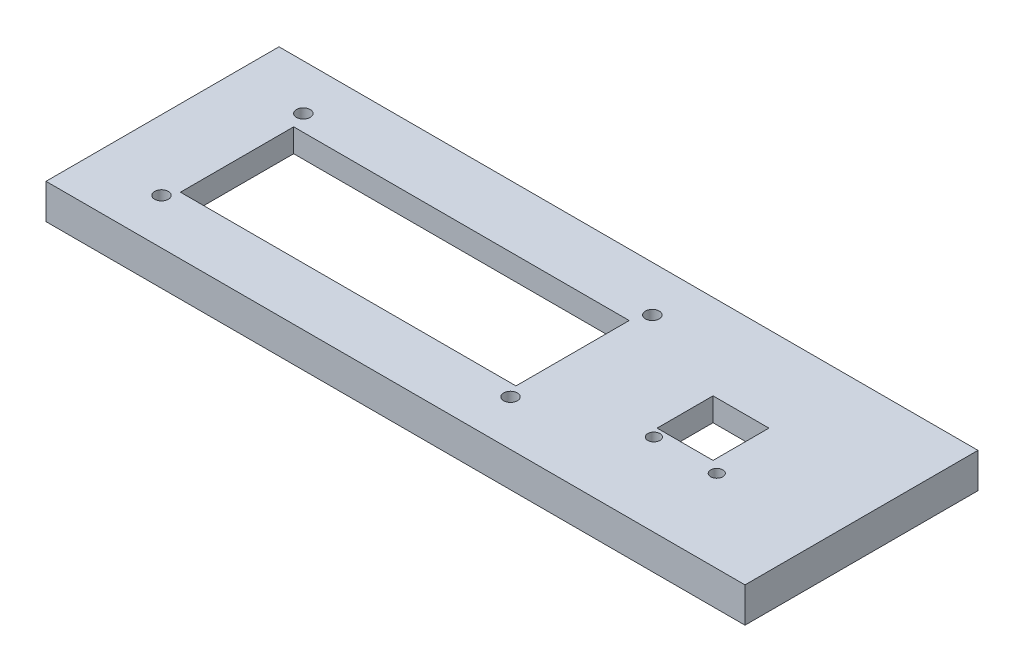
from build123d import *

# Parameters (mm, degrees)
SKETCH2_W           = 150
SKETCH2_H           = 50
BOSS_EXTRUDE1_DEPTH = 7.5
SKETCH3_R           = 1.475
CUT_EXTRUDE1_DEPTH  = 159.291661183
SKETCH4_R           = 1.3
CUT_EXTRUDE2_DEPTH  = 159.291661183
SKETCH6_W           = 140
SKETCH6_H           = 40
CUT_EXTRUDE3_DEPTH  = 2.5
SKETCH8_W           = 72
SKETCH8_H           = 24.3
CUT_EXTRUDE4_DEPTH  = 159.291661183
SKETCH9_W           = 12
SKETCH9_H           = 12
CUT_EXTRUDE5_DEPTH  = 159.291661183


with BuildPart() as part:
    # Sketch2 → Boss-Extrude1 (new body)
    with BuildSketch(Plane(origin=(0, 0, 0), x_dir=(1, 0, 0), z_dir=(0, 1, 0))):
        with Locations((75, 25)):
            Rectangle(SKETCH2_W, SKETCH2_H)
    extrude(amount=BOSS_EXTRUDE1_DEPTH)

    # Sketch3 → Cut-Extrude1 (cut, through all)
    with BuildSketch(Plane(origin=(0, 7.5, 0), x_dir=(1, 0, 0), z_dir=(0, 1, 0))):
        with Locations(Location((15, 40.216322293, 0), (0, 0, 270))):
            Circle(SKETCH3_R)
        with Locations(Location((89.9, 40.216322293, 0), (0, 0, 270))):
            Circle(SKETCH3_R)
        with Locations(Location((89.9, 9.783677707, 0), (0, 0, 270))):
            Circle(SKETCH3_R)
        with Locations(Location((15, 9.783677707, 0), (0, 0, 270))):
            Circle(SKETCH3_R)
    extrude(amount=-CUT_EXTRUDE1_DEPTH, mode=Mode.SUBTRACT)

    # Sketch4 → Cut-Extrude2 (cut, through all)
    with BuildSketch(Plane(origin=(0, 7.5, 0), x_dir=(1, 0, 0), z_dir=(0, 1, 0))):
        with Locations(Location((112.738384592, 17.7, 0), (0, 0, 270))):
            Circle(SKETCH4_R)
        with Locations(Location((126.238384592, 17.7, 0), (0, 0, 270))):
            Circle(SKETCH4_R)
    extrude(amount=-CUT_EXTRUDE2_DEPTH, mode=Mode.SUBTRACT)

    # Sketch6 → Cut-Extrude3 (cut)
    with BuildSketch(Plane.XZ):
        with Locations((75, -25)):
            Rectangle(SKETCH6_W, SKETCH6_H)
    extrude(amount=-CUT_EXTRUDE3_DEPTH, mode=Mode.SUBTRACT)

    # Sketch8 → Cut-Extrude4 (cut, through all)
    with BuildSketch(Plane(origin=(0, 7.5, 0), x_dir=(1, 0, 0), z_dir=(0, 1, 0))):
        with Locations((52.45, 24.55)):
            Rectangle(SKETCH8_W, SKETCH8_H)
    extrude(amount=-CUT_EXTRUDE4_DEPTH, mode=Mode.SUBTRACT)

    # Sketch9 → Cut-Extrude5 (cut, through all)
    with BuildSketch(Plane(origin=(0, 7.5, 0), x_dir=(1, 0, 0), z_dir=(0, 1, 0))):
        with Locations((117.438384592, 25.7)):
            Rectangle(SKETCH9_W, SKETCH9_H)
    extrude(amount=-CUT_EXTRUDE5_DEPTH, mode=Mode.SUBTRACT)


solid = part.part
